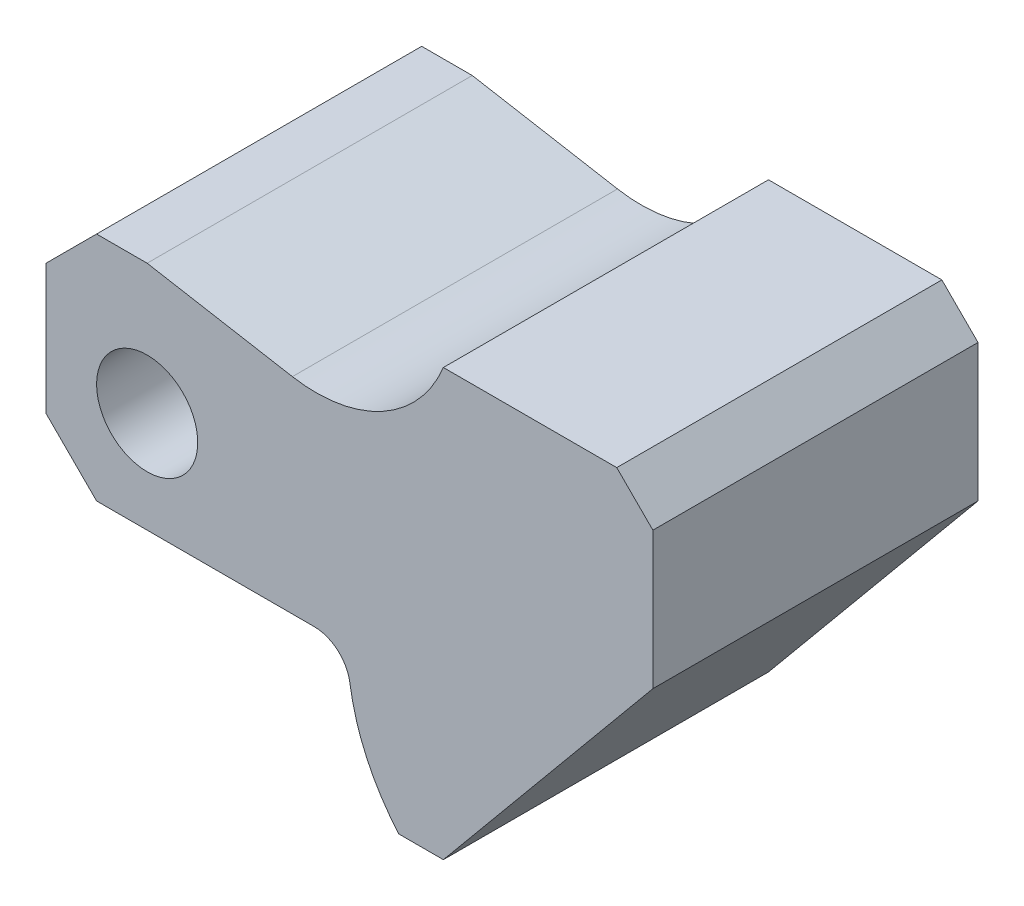
from build123d import *

# Parameters (mm, degrees)
ESQUISSE1_R        = 7
BOSS_EXTRU_2_DEPTH = 45


with BuildPart() as part:
    # Esquisse1 → Boss.-Extru.2 (new body)
    with BuildSketch(Plane.XY):
        with BuildLine():
            Line((38.010307264, -3.230818644), (62.010307264, -3.230818644))
            Line((62.010307264, -3.230818644), (67.010307264, -8.230818644))
            Line((67.010307264, -8.230818644), (67.010307264, -27.230818644))
            Line((67.010307264, -27.230818644), (38.010307264, -62.230818644))
            Line((38.010307264, -62.230818644), (31.844262107, -62.230818644))
            ThreePointArc((31.844262107, -62.230818644), (27.40528991, -55.346490705), (25.068459707, -47.495524527))
            ThreePointArc((25.068459707, -47.495524527), (23.388056746, -44.444232412), (20.122820965, -43.230818644))
            Line((20.122820965, -43.230818644), (-9.989692736, -43.230818644))
            Line((-9.989692736, -43.230818644), (-16.989692736, -36.230818644))
            Line((-16.989692736, -36.230818644), (-16.989692736, -18.230818644))
            Line((-16.989692736, -18.230818644), (-9.989692736, -11.230818644))
            Line((-9.989692736, -11.230818644), (-2.989692736, -11.230818644))
            Line((-2.989692736, -11.230818644), (17.114349616, -14.775703732))
            ThreePointArc((17.114349616, -14.775703732), (29.601944593, -12.694916187), (38.010307264, -3.230818644))
        make_face()
        with Locations(Location((-2.989692736, -29.230818644, 0), (0, 0, 180))):
            Circle(ESQUISSE1_R, mode=Mode.SUBTRACT)
    extrude(amount=BOSS_EXTRU_2_DEPTH)


solid = part.part
